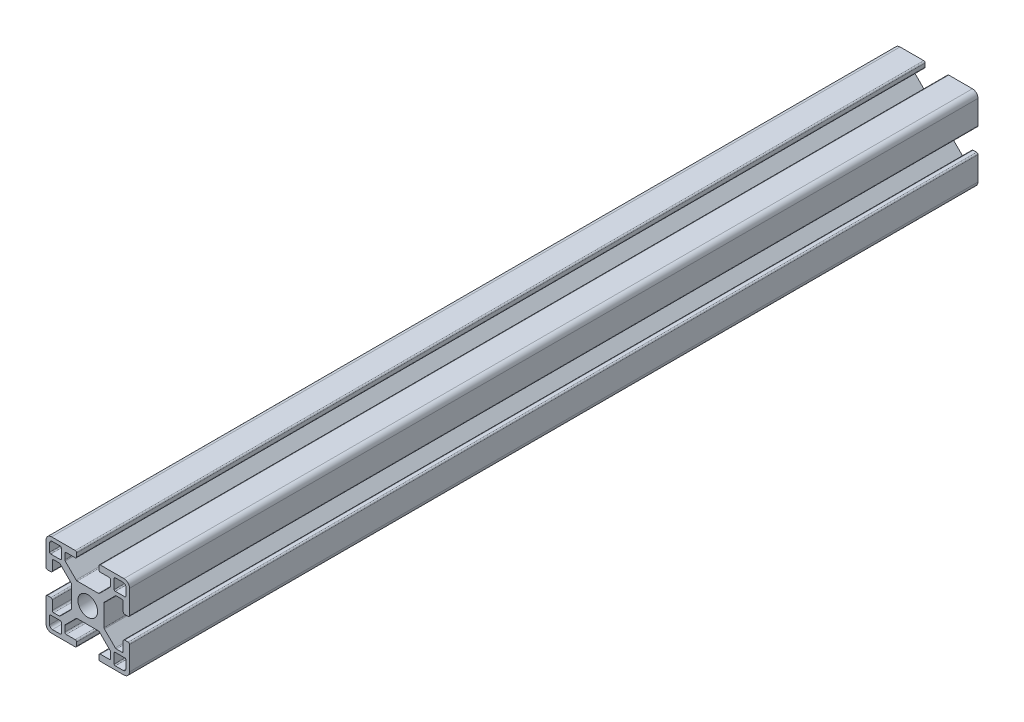
from build123d import *

# Parameters (mm, degrees)
SKETCH1_R           = 3.52998588
BOSS_EXTRUDE1_DEPTH = 152.4


with BuildPart() as part:
    # Sketch1 → Boss-Extrude1 (new, symmetric)
    with BuildSketch(Plane.XY):
        with BuildLine():
            Line((14.49994, -4), (13.24247465, -4))
            ThreePointArc((13.24247465, -4), (12.88892126, -4.146446609), (12.74247465, -4.5))
            Line((12.74247465, -4.5), (12.74247465, -7.732519321))
            ThreePointArc((12.74247465, -7.732519321), (12.602449697, -8.097296796), (12.242781236, -8.249967))
            Line((12.242781236, -8.249967), (10.260188032, -8.249967))
            ThreePointArc((10.260188032, -8.249967), (10.068847082, -8.211906919), (9.906636056, -8.103520976))
            Line((9.906636056, -8.103520976), (5.981117769, -4.178002689))
            ThreePointArc((5.981117769, -4.178002689), (5.872731827, -4.015791664), (5.834671745, -3.824450713))
            Line((5.834671745, -3.824450713), (5.834671745, -1.01249595))
            Line((5.834671745, -1.01249595), (5.834671745, 0.88749645))
            Line((5.834671745, 0.88749645), (5.834671745, 3.824450713))
            ThreePointArc((5.834671745, 3.824450713), (5.872731827, 4.015791664), (5.981117769, 4.178002689))
            Line((5.981117769, 4.178002689), (9.906636056, 8.103520976))
            ThreePointArc((9.906636056, 8.103520976), (10.068847082, 8.211906919), (10.260188032, 8.249967))
            Line((10.260188032, 8.249967), (12.242781236, 8.249967))
            ThreePointArc((12.242781236, 8.249967), (12.602449697, 8.097296796), (12.74247465, 7.732519321))
            Line((12.74247465, 7.732519321), (12.74247465, 4.5))
            ThreePointArc((12.74247465, 4.5), (12.88892126, 4.146446609), (13.24247465, 4))
            Line((13.24247465, 4), (14.49994, 4))
            ThreePointArc((14.49994, 4), (14.853493391, 4.146446609), (14.99994, 4.5))
            Line((14.99994, 4.5), (14.99994, 12.999948))
            ThreePointArc((14.99994, 12.999948), (14.414155906, 14.414155906), (12.999948, 14.99994))
            Line((12.999948, 14.99994), (4.5, 14.99994))
            ThreePointArc((4.5, 14.99994), (4.146446609, 14.853493391), (4, 14.49994))
            Line((4, 14.49994), (4, 13.24247465))
            ThreePointArc((4, 13.24247465), (4.146446609, 12.88892126), (4.5, 12.74247465))
            Line((4.5, 12.74247465), (7.732519321, 12.74247465))
            ThreePointArc((7.732519321, 12.74247465), (8.097296796, 12.602449697), (8.249967, 12.242781236))
            Line((8.249967, 12.242781236), (8.249967, 10.260188032))
            ThreePointArc((8.249967, 10.260188032), (8.211906919, 10.068847082), (8.103520976, 9.906636056))
            Line((8.103520976, 9.906636056), (4.178002689, 5.981117769))
            ThreePointArc((4.178002689, 5.981117769), (4.015791664, 5.872731827), (3.824450713, 5.834671745))
            Line((3.824450713, 5.834671745), (0.9499962, 5.834671745))
            Line((0.9499962, 5.834671745), (-0.9499962, 5.834671745))
            Line((-0.9499962, 5.834671745), (-3.824450713, 5.834671745))
            ThreePointArc((-3.824450713, 5.834671745), (-4.015791664, 5.872731827), (-4.178002689, 5.981117769))
            Line((-4.178002689, 5.981117769), (-8.103520976, 9.906636056))
            ThreePointArc((-8.103520976, 9.906636056), (-8.211906919, 10.068847082), (-8.249967, 10.260188032))
            Line((-8.249967, 10.260188032), (-8.249967, 12.242781236))
            ThreePointArc((-8.249967, 12.242781236), (-8.097296796, 12.602449697), (-7.732519321, 12.74247465))
            Line((-7.732519321, 12.74247465), (-4.5, 12.74247465))
            ThreePointArc((-4.5, 12.74247465), (-4.146446609, 12.88892126), (-4, 13.24247465))
            Line((-4, 13.24247465), (-4, 14.49994))
            ThreePointArc((-4, 14.49994), (-4.146446609, 14.853493391), (-4.5, 14.99994))
            Line((-4.5, 14.99994), (-12.999948, 14.99994))
            ThreePointArc((-12.999948, 14.99994), (-14.414155906, 14.414155906), (-14.99994, 12.999948))
            Line((-14.99994, 12.999948), (-14.99994, 4.5))
            ThreePointArc((-14.99994, 4.5), (-14.853493391, 4.146446609), (-14.49994, 4))
            Line((-14.49994, 4), (-13.24247465, 4))
            ThreePointArc((-13.24247465, 4), (-12.88892126, 4.146446609), (-12.74247465, 4.5))
            Line((-12.74247465, 4.5), (-12.74247465, 7.732519321))
            ThreePointArc((-12.74247465, 7.732519321), (-12.602449697, 8.097296796), (-12.242781236, 8.249967))
            Line((-12.242781236, 8.249967), (-10.260188032, 8.249967))
            ThreePointArc((-10.260188032, 8.249967), (-10.068847082, 8.211906919), (-9.906636056, 8.103520976))
            Line((-9.906636056, 8.103520976), (-5.981117769, 4.178002689))
            ThreePointArc((-5.981117769, 4.178002689), (-5.872731827, 4.015791664), (-5.834671745, 3.824450713))
            Line((-5.834671745, 3.824450713), (-5.834671745, 0.88749645))
            Line((-5.834671745, 0.88749645), (-5.834671745, -1.01249595))
            Line((-5.834671745, -1.01249595), (-5.834671745, -3.824450713))
            ThreePointArc((-5.834671745, -3.824450713), (-5.872731827, -4.015791664), (-5.981117769, -4.178002689))
            Line((-5.981117769, -4.178002689), (-9.906636056, -8.103520976))
            ThreePointArc((-9.906636056, -8.103520976), (-10.068847082, -8.211906919), (-10.260188032, -8.249967))
            Line((-10.260188032, -8.249967), (-12.242781236, -8.249967))
            ThreePointArc((-12.242781236, -8.249967), (-12.602449697, -8.097296796), (-12.74247465, -7.732519321))
            Line((-12.74247465, -7.732519321), (-12.74247465, -4.5))
            ThreePointArc((-12.74247465, -4.5), (-12.88892126, -4.146446609), (-13.24247465, -4))
            Line((-13.24247465, -4), (-14.49994, -4))
            ThreePointArc((-14.49994, -4), (-14.853493391, -4.146446609), (-14.99994, -4.5))
            Line((-14.99994, -4.5), (-14.99994, -12.999948))
            ThreePointArc((-14.99994, -12.999948), (-14.414155906, -14.414155906), (-12.999948, -14.99994))
            Line((-12.999948, -14.99994), (-4.5, -14.99994))
            ThreePointArc((-4.5, -14.99994), (-4.146446609, -14.853493391), (-4, -14.49994))
            Line((-4, -14.49994), (-4, -13.24247465))
            ThreePointArc((-4, -13.24247465), (-4.146446609, -12.88892126), (-4.5, -12.74247465))
            Line((-4.5, -12.74247465), (-7.732519321, -12.74247465))
            ThreePointArc((-7.732519321, -12.74247465), (-8.097296796, -12.602449697), (-8.249967, -12.242781236))
            Line((-8.249967, -12.242781236), (-8.249967, -10.260188032))
            ThreePointArc((-8.249967, -10.260188032), (-8.211906919, -10.068847082), (-8.103520976, -9.906636056))
            Line((-8.103520976, -9.906636056), (-4.178002689, -5.981117769))
            ThreePointArc((-4.178002689, -5.981117769), (-4.015791664, -5.872731827), (-3.824450713, -5.834671745))
            Line((-3.824450713, -5.834671745), (-0.9499962, -5.834671745))
            Line((-0.9499962, -5.834671745), (0.9499962, -5.834671745))
            Line((0.9499962, -5.834671745), (3.824450713, -5.834671745))
            ThreePointArc((3.824450713, -5.834671745), (4.015791664, -5.872731827), (4.178002689, -5.981117769))
            Line((4.178002689, -5.981117769), (8.103520976, -9.906636056))
            ThreePointArc((8.103520976, -9.906636056), (8.211906919, -10.068847082), (8.249967, -10.260188032))
            Line((8.249967, -10.260188032), (8.249967, -12.242781236))
            ThreePointArc((8.249967, -12.242781236), (8.097296796, -12.602449697), (7.732519321, -12.74247465))
            Line((7.732519321, -12.74247465), (4.5, -12.74247465))
            ThreePointArc((4.5, -12.74247465), (4.146446609, -12.88892126), (4, -13.24247465))
            Line((4, -13.24247465), (4, -14.49994))
            ThreePointArc((4, -14.49994), (4.146446609, -14.853493391), (4.5, -14.99994))
            Line((4.5, -14.99994), (12.999948, -14.99994))
            ThreePointArc((12.999948, -14.99994), (14.414155906, -14.414155906), (14.99994, -12.999948))
            Line((14.99994, -12.999948), (14.99994, -4.5))
            ThreePointArc((14.99994, -4.5), (14.853493391, -4.146446609), (14.49994, -4))
        make_face()
        with Locations(Location((0, 0, 0), (0, 0, 180))):
            Circle(SKETCH1_R, mode=Mode.SUBTRACT)
        with BuildLine():
            Line((-12.6999492, -13.6999452), (-9.880960476, -13.6999452))
            ThreePointArc((-9.880960476, -13.6999452), (-9.61155387, -13.58835333), (-9.499962, -13.318946724))
            Line((-9.499962, -13.318946724), (-9.499962, -9.87996048))
            ThreePointArc((-9.499962, -9.87996048), (-9.611260978, -9.611260978), (-9.87996048, -9.499962))
            Line((-9.87996048, -9.499962), (-13.318946724, -9.499962))
            ThreePointArc((-13.318946724, -9.499962), (-13.58835333, -9.61155387), (-13.6999452, -9.880960476))
            Line((-13.6999452, -9.880960476), (-13.6999452, -12.6999492))
            ThreePointArc((-13.6999452, -12.6999492), (-13.407053153, -13.407053153), (-12.6999492, -13.6999452))
        make_face(mode=Mode.SUBTRACT)
        with BuildLine():
            Line((13.6999452, -12.6999492), (13.6999452, -9.880960476))
            ThreePointArc((13.6999452, -9.880960476), (13.58835333, -9.61155387), (13.318946724, -9.499962))
            Line((13.318946724, -9.499962), (9.87996048, -9.499962))
            ThreePointArc((9.87996048, -9.499962), (9.611260978, -9.611260978), (9.499962, -9.87996048))
            Line((9.499962, -9.87996048), (9.499962, -13.318946724))
            ThreePointArc((9.499962, -13.318946724), (9.61155387, -13.58835333), (9.880960476, -13.6999452))
            Line((9.880960476, -13.6999452), (12.6999492, -13.6999452))
            ThreePointArc((12.6999492, -13.6999452), (13.407053153, -13.407053153), (13.6999452, -12.6999492))
        make_face(mode=Mode.SUBTRACT)
        with BuildLine():
            Line((9.87996048, 9.499962), (13.318946724, 9.499962))
            ThreePointArc((13.318946724, 9.499962), (13.58835333, 9.61155387), (13.6999452, 9.880960476))
            Line((13.6999452, 9.880960476), (13.6999452, 12.6999492))
            ThreePointArc((13.6999452, 12.6999492), (13.407053153, 13.407053153), (12.6999492, 13.6999452))
            Line((12.6999492, 13.6999452), (9.880960476, 13.6999452))
            ThreePointArc((9.880960476, 13.6999452), (9.61155387, 13.58835333), (9.499962, 13.318946724))
            Line((9.499962, 13.318946724), (9.499962, 9.87996048))
            ThreePointArc((9.499962, 9.87996048), (9.611260978, 9.611260978), (9.87996048, 9.499962))
        make_face(mode=Mode.SUBTRACT)
        with BuildLine():
            Line((-13.6999452, 12.6999492), (-13.6999452, 9.880960476))
            ThreePointArc((-13.6999452, 9.880960476), (-13.58835333, 9.61155387), (-13.318946724, 9.499962))
            Line((-13.318946724, 9.499962), (-9.87996048, 9.499962))
            ThreePointArc((-9.87996048, 9.499962), (-9.611260978, 9.611260978), (-9.499962, 9.87996048))
            Line((-9.499962, 9.87996048), (-9.499962, 13.318946724))
            ThreePointArc((-9.499962, 13.318946724), (-9.61155387, 13.58835333), (-9.880960476, 13.6999452))
            Line((-9.880960476, 13.6999452), (-12.6999492, 13.6999452))
            ThreePointArc((-12.6999492, 13.6999452), (-13.407053153, 13.407053153), (-13.6999452, 12.6999492))
        make_face(mode=Mode.SUBTRACT)
    extrude(amount=BOSS_EXTRUDE1_DEPTH, both=True)


solid = part.part
